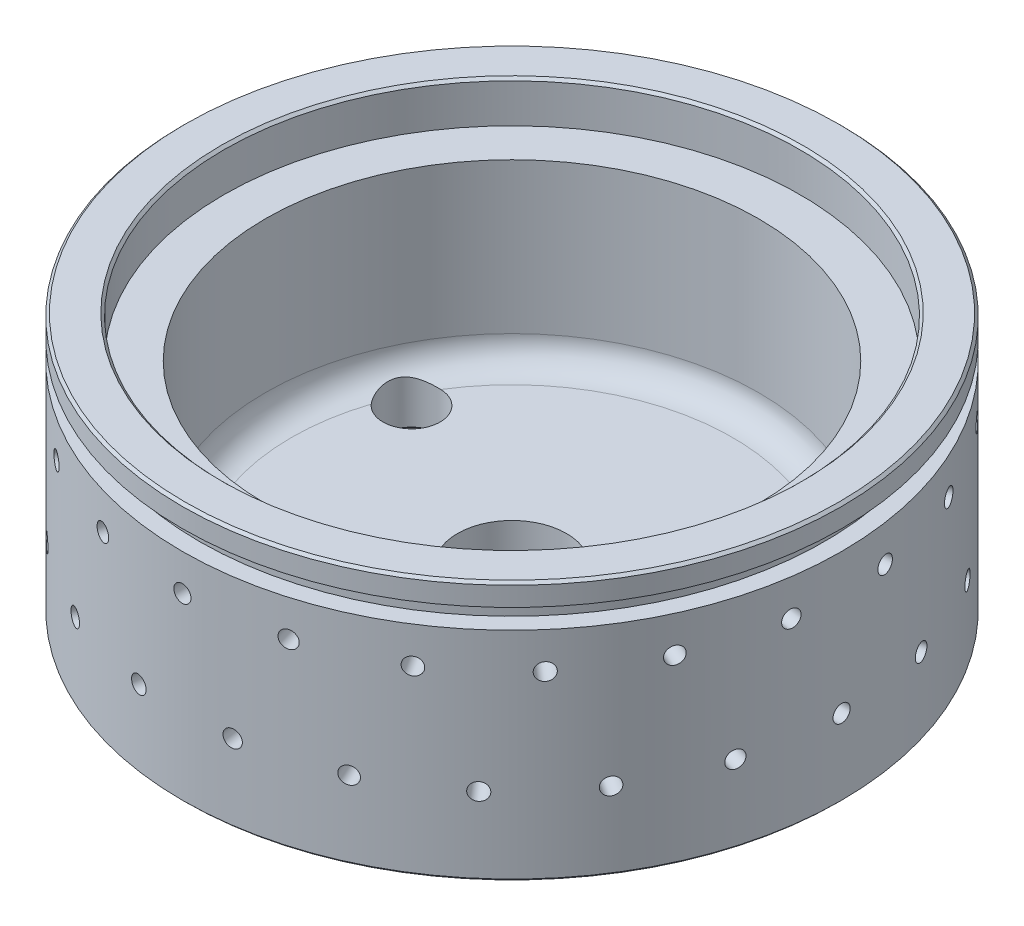
from build123d import *

# Parameters (mm, degrees)
SKETCH2_W                        = 3.3
SKETCH2_H                        = 3.8
FILLET1_R                        = 5
CHAMFER1_SIZE                    = 0.5
CIRPATTERN1_COUNT                = 22
CIRPATTERN2_COUNT                = 22
G5_8_TAPPED_HOLE1_D              = 21
G3_8_TAPPED_HOLE1_D              = 15.25
M12X1_0_TAPPED_HOLE1_D           = 11
M12X1_0_TAPPED_HOLE1_DEPTH       = 23.695266595
M12X1_0_TAPPED_HOLE1_CSINK_D     = 12.05
M12X1_0_TAPPED_HOLE1_CSINK_ANGLE = 90
M12X1_0_TAPPED_HOLE1_TIP         = 3.304733405


with BuildPart() as part:
    # Sketch1 → Revolve1 (revolve)
    with BuildSketch(Plane.XY):
        Polygon((0, 0), (63.5, 0), (63.5, 50), (55.5, 50), (55.5, 42), (47.5, 42), (47.5, 8), (0, 8), align=None)
    revolve(axis=Axis((0, -55.144736842, 0), (0, 1, 0)))

    # Sketch2 → Cut-Revolve1 (revolve, cut)
    with BuildSketch(Plane.XY, mode=Mode.PRIVATE) as cut_revolve1_sk:
        with Locations((-61.85, 43.9)):
            Rectangle(SKETCH2_W, SKETCH2_H)
    revolve(cut_revolve1_sk.sketch.rotate(Axis((0, -69.868690159, 0), (0, 1, 0)), 180), axis=Axis((0, -69.868690159, 0), (0, 1, 0)), mode=Mode.SUBTRACT)

    # Fillet1
    fillet1_edges = [part.edges().sort_by_distance(p)[0] for p in [
        (-47.5, 8, 0),
    ]]
    fillet(fillet1_edges, radius=FILLET1_R)

    # Chamfer1
    chamfer1_edges = [part.edges().sort_by_distance(p)[0] for p in [
        (-55.5, 50, 0),
        (-63.5, 50, 0),
        (-63.5, 0, 0),
    ]]
    chamfer(chamfer1_edges, length=CHAMFER1_SIZE)

    # Sketch4 → M4x0.7 Tapped Hole1 (revolve, cut)
    with BuildSketch(Plane(origin=(-63.5, 15, 0), x_dir=(0, 0, 1), z_dir=(0, 1, 0))):
        Polygon((0, 0), (0, 10), (1.65, 9.008579979), (1.65, 0), align=None)
    m4x0_7_tapped_hole1 = revolve(axis=Axis((-69.85, 15, 0), (1, 0, 0)), mode=Mode.SUBTRACT)

    # CirPattern1: M4x0.7 Tapped Hole1 ×22 about axis
    cirpattern1_axis = Axis((0, -55.144736842, 0), (0, -1, 0))
    for i in range(1, CIRPATTERN1_COUNT):
        add(m4x0_7_tapped_hole1.rotate(cirpattern1_axis, i * 360 / CIRPATTERN1_COUNT), mode=Mode.SUBTRACT)

    # Sketch6 → M4x0.7 Tapped Hole2 (revolve, cut)
    with BuildSketch(Plane(origin=(-62.85366156, 35, -9.036992228), x_dir=(-0.1423148382418752, 0, 0.9898214418854488), z_dir=(0, 1, 0))):
        Polygon((0, 0), (0, 10), (1.65, 9.008579979), (1.65, 0), align=None)
    m4x0_7_tapped_hole2 = revolve(axis=Axis((-69.139027716, 35, -9.940691451), (0.9898214418854488, 3.4190595334038114e-15, 0.1423148382418752)), mode=Mode.SUBTRACT)

    # CirPattern2: M4x0.7 Tapped Hole2 ×22 about axis
    cirpattern2_axis = Axis((0, -55.144736842, 0), (0, -1, 0))
    for i in range(1, CIRPATTERN2_COUNT):
        add(m4x0_7_tapped_hole2.rotate(cirpattern2_axis, i * 360 / CIRPATTERN2_COUNT), mode=Mode.SUBTRACT)

    # G5/8 Tapped Hole1 (through all)
    with Locations(Plane(origin=(0, 0, 0), x_dir=(-1, 0, 0), z_dir=(0, -1, 0))):
        with Locations((0, 0)):
            Hole(G5_8_TAPPED_HOLE1_D / 2)

    # G3/8 Tapped Hole1 (through all)
    with Locations(Plane(origin=(0, 0, 0), x_dir=(-1, 0, 0), z_dir=(0, -1, 0))):
        with Locations((-37.5, 0)):
            Hole(G3_8_TAPPED_HOLE1_D / 2)

    # M12x1.0 Tapped Hole1
    with Locations(Plane(origin=(0, 0, 0), x_dir=(-1, 0, 0), z_dir=(0, -1, 0))):
        with Locations((36.252311481, 16.90473047)):
            CounterSinkHole(M12X1_0_TAPPED_HOLE1_D / 2, M12X1_0_TAPPED_HOLE1_CSINK_D / 2, depth=M12X1_0_TAPPED_HOLE1_DEPTH, counter_sink_angle=M12X1_0_TAPPED_HOLE1_CSINK_ANGLE)
            with Locations((0, 0, -(M12X1_0_TAPPED_HOLE1_DEPTH + M12X1_0_TAPPED_HOLE1_TIP / 2))):  # 118° drill point
                Cone(0, M12X1_0_TAPPED_HOLE1_D / 2, M12X1_0_TAPPED_HOLE1_TIP, mode=Mode.SUBTRACT)


solid = part.part
